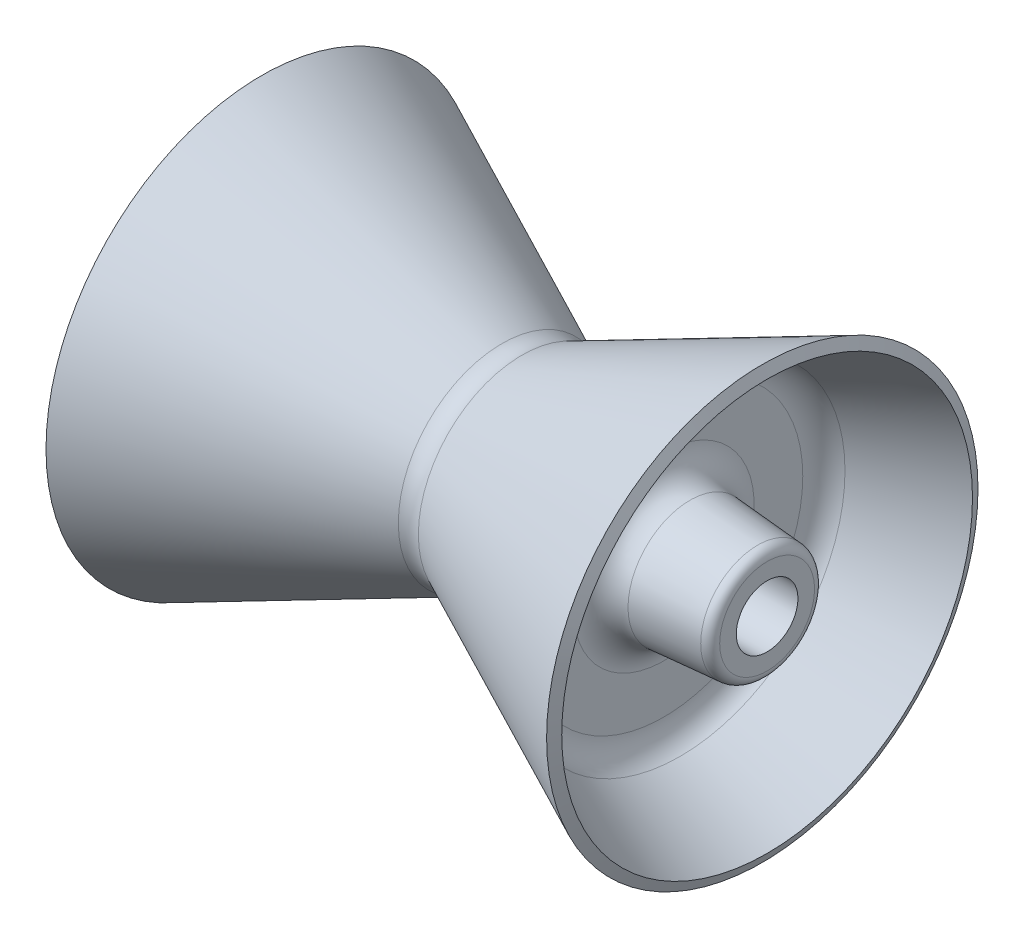
from build123d import *


with BuildPart() as part:
    # Sketch1 → Revolve1 (revolve)
    with BuildSketch(Plane.XY, mode=Mode.PRIVATE) as revolve1_sk:
        with BuildLine():
            Line((130, 32.5), (269.015, 32.5))
            Line((269.015, 32.5), (269.015, 50))
            ThreePointArc((269.015, 50), (266.086067812, 57.071067812), (259.015, 60))
            Line((259.015, 60), (187.734107976, 65.399249509))
            ThreePointArc((187.734107976, 65.399249509), (168.000264084, 74.917193107), (160, 95.313556009))
            Line((160, 95.313556009), (160, 146.637669378))
            ThreePointArc((160, 146.637669378), (164.698256626, 162.756657628), (177.321452148, 173.826902989))
            Line((177.321452148, 173.826902989), (269.015, 216.584306556))
            Line((269.015, 216.584306556), (263.943580859, 227.46))
            Line((263.943580859, 227.46), (10.565456544, 109.307840223))
            ThreePointArc((10.565456544, 109.307840223), (0, 106.965534899), (-10.565456544, 109.307840223))
            Line((-10.565456544, 109.307840223), (-263.943580859, 227.46))
            Line((-263.943580859, 227.46), (-269.015, 216.584306556))
            Line((-269.015, 216.584306556), (-177.321452148, 173.826902989))
            ThreePointArc((-177.321452148, 173.826902989), (-164.698256626, 162.756657628), (-160, 146.637669378))
            Line((-160, 146.637669378), (-160, 95.313556009))
            ThreePointArc((-160, 95.313556009), (-168.000264084, 74.917193107), (-187.734107976, 65.399249509))
            Line((-187.734107976, 65.399249509), (-259.015, 60))
            ThreePointArc((-259.015, 60), (-266.086067812, 57.071067812), (-269.015, 50))
            Line((-269.015, 50), (-269.015, 32.5))
            Line((-269.015, 32.5), (-130, 32.5))
            Line((-130, 32.5), (-130, 104.669980144))
            ThreePointArc((-130, 104.669980144), (-116.11898825, 129.971723518), (-87.321452148, 131.859213755))
            Line((-87.321452148, 131.859213755), (-10.565456544, 96.067305195))
            ThreePointArc((-10.565456544, 96.067305195), (0, 93.724999871), (10.565456544, 96.067305195))
            Line((10.565456544, 96.067305195), (87.321452148, 131.859213755))
            ThreePointArc((87.321452148, 131.859213755), (116.11898825, 129.971723518), (130, 104.669980144))
            Line((130, 104.669980144), (130, 32.5))
        make_face()
    revolve(revolve1_sk.sketch.rotate(Axis((-518.637167429, 0, 0), (1, 0, 0)), 90), axis=Axis((-518.637167429, 0, 0), (1, 0, 0)))


solid = part.part
